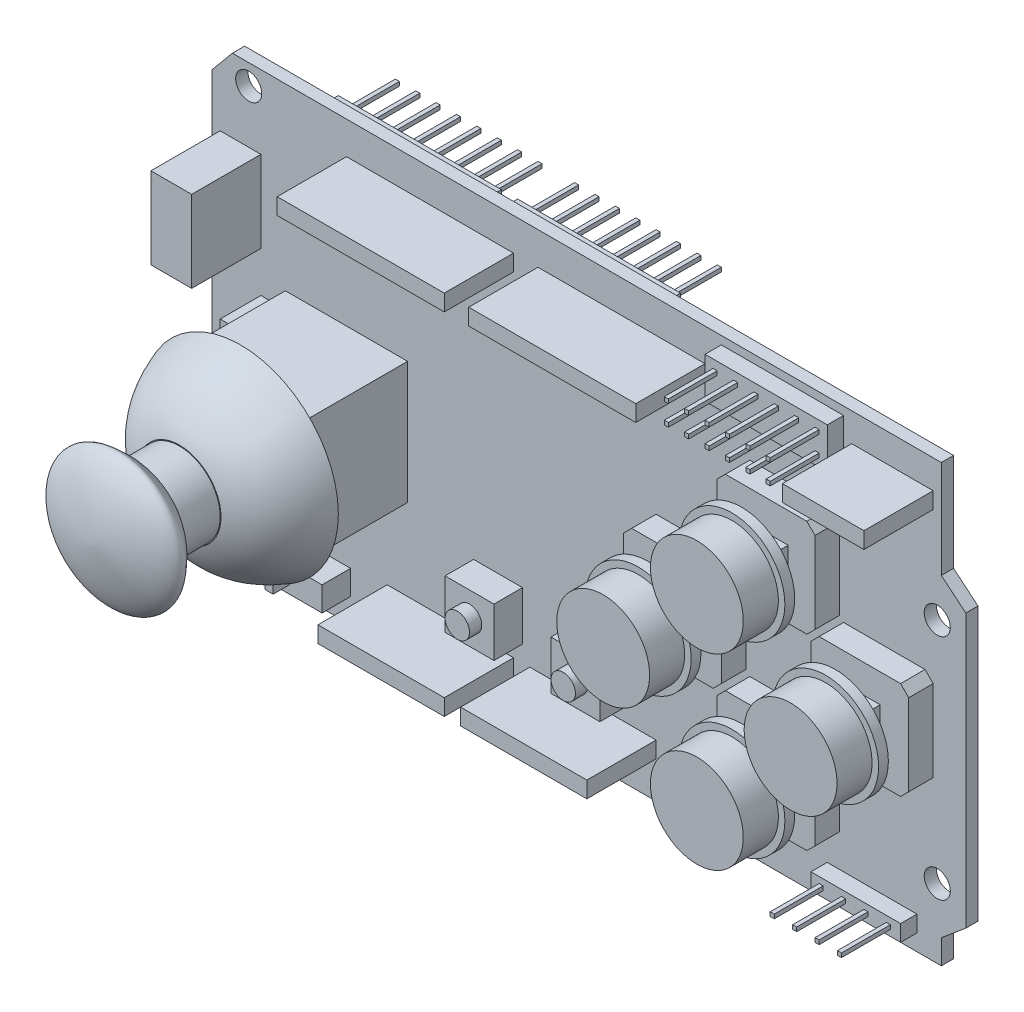
from build123d import *

# Parameters (mm, degrees)
EXTRUDE_1_DEPTH            = 1.5
SKETCH_3_R                 = 1.6
CUT_EXTRUDE_1_DEPTH        = 104.853261865
SKETCH_4_W                 = 12
SKETCH_4_H                 = 12
EXTRUDE_2_DEPTH            = 3
CHAMFER_1_SIZE             = 1
CHAMFER_1_OF_MIRROR_1_SIZE = 1
EXTRUDE_4_DEPTH            = 3
SKETCH_7_W                 = 5
SKETCH_7_H                 = 5
EXTRUDE_5_DEPTH            = 3
SKETCH_8_R                 = 6.5
EXTRUDE_6_DEPTH            = 1.2
SKETCH_9_R                 = 5.7
EXTRUDE_7_DEPTH            = 4.3
SKETCH_10_R                = 6.5
EXTRUDE_8_DEPTH            = 1.2
SKETCH_11_R                = 5.7
EXTRUDE_9_DEPTH            = 4.3
EXTRUDE_10_DEPTH           = 13
SKETCH_16_R                = 5.1
EXTRUDE_11_DEPTH           = 13
SKETCH_18_W                = 3
SKETCH_18_H                = 8
CUT_EXTRUDE_2_DEPTH        = 99.132563425
SKETCH_19_R                = 5
EXTRUDE_12_DEPTH           = 5
SKETCH_21_W                = 15
SKETCH_21_H                = 5
EXTRUDE_13_DEPTH           = 2
SKETCH_22_W                = 11
SKETCH_22_H                = 2
EXTRUDE_14_DEPTH           = 2
SKETCH_23_W                = 0.5
SKETCH_23_H                = 0.5
EXTRUDE_15_DEPTH           = 6
PATTERN_LINEAR_1_COUNT     = 4
PATTERN_LINEAR_1_PITCH     = 2.75
SKETCH_24_W                = 0.5
SKETCH_24_H                = 0.5
EXTRUDE_16_DEPTH           = 6
PATTERN_LINEAR_2_COUNT     = 6
PATTERN_LINEAR_2_PITCH     = 2.5
SKETCH_25_W                = 10
SKETCH_25_H                = 2
SKETCH_25_W_2              = 20.5
SKETCH_25_W_3              = 5
SKETCH_25_H_2              = 10
SKETCH_25_W_4              = 15.5
EXTRUDE_17_DEPTH           = 8.5
SKETCH_26_W                = 9
SKETCH_26_H                = 3
EXTRUDE_18_DEPTH           = 3.5
SKETCH_27_W                = 1
SKETCH_27_H                = 1
EXTRUDE_19_DEPTH           = 2
SKETCH_28_W                = 6
SKETCH_28_H                = 6
EXTRUDE_20_DEPTH           = 3.5
SKETCH_29_R                = 1.5
EXTRUDE_21_DEPTH           = 1.5
SKETCH_30_W                = 15
SKETCH_30_H                = 2
SKETCH_30_W_2              = 20
EXTRUDE_22_DEPTH           = 2
SKETCH_31_W                = 0.5
SKETCH_31_H                = 0.5
EXTRUDE_23_DEPTH           = 6
PATTERN_LINEAR_3_COUNT     = 6
PATTERN_LINEAR_3_PITCH     = 2.5
SKETCH_32_W                = 0.5
SKETCH_32_H                = 0.5
EXTRUDE_24_DEPTH           = 6
PATTERN_LINEAR_4_COUNT     = 8
PATTERN_LINEAR_4_PITCH     = 2.5


with BuildPart() as part:
    # 草图2 → 凸台-拉伸1 (new body)
    with BuildSketch(Plane.XY):
        Polygon((0, 0), (86, 0), (86, 3), (89, 5.5), (89, 39), (86, 41.5), (86, 53.5), (-1, 53.5), (-3.5, 50.5), (-3.5, 17.5), (0, 14), align=None)
    extrude(amount=EXTRUDE_1_DEPTH)

    # 草图3 → 切除-拉伸1 (cut, through all)
    with BuildSketch(Plane.XY.offset(1.5)):
        with Locations((85.5, 36.5)):
            Circle(SKETCH_3_R)
        with Locations((85.5, 8.5)):
            Circle(SKETCH_3_R)
        with Locations((1, 51)):
            Circle(SKETCH_3_R)
    extrude(amount=-CUT_EXTRUDE_1_DEPTH, mode=Mode.SUBTRACT)

    # 草图4 → 凸台-拉伸2 (add)
    with BuildSketch(Plane.XY.offset(1.5)):
        with Locations((79, 24.5)):
            Rectangle(SKETCH_4_W, SKETCH_4_H)
    extrude_2 = extrude(amount=EXTRUDE_2_DEPTH)

    # 倒角1
    chamfer_1_edges = [part.edges().sort_by_distance(p)[0] for p in [
        (85, 18.5, 3),
        (85, 30.5, 3),
        (73, 30.5, 3),
        (73, 18.5, 3),
    ]]
    chamfer(chamfer_1_edges, length=CHAMFER_1_SIZE)

    # 镜向1: 凸台-拉伸2 across plane
    add(extrude_2.mirror(Plane.ZY.offset(-67.5)))

    # 倒角1 of 镜向1
    chamfer_1_of_mirror_1_edges = [part.edges().sort_by_distance(p)[0] for p in [
        (50, 18.5, 3),
        (50, 30.5, 3),
        (62, 30.5, 3),
        (62, 18.5, 3),
    ]]
    chamfer(chamfer_1_of_mirror_1_edges, length=CHAMFER_1_OF_MIRROR_1_SIZE)

    # 草图6 → 凸台-拉伸4 (add)
    with BuildSketch(Plane.XY.offset(1.5)):
        Polygon((72.5, 42), (73.5, 41), (73.5, 31), (72.5, 30), (62.5, 30), (61.5, 31), (61.5, 41), (62.5, 42), align=None)
        Polygon((72.5, 19), (62.5, 19), (61.5, 18), (61.5, 8), (62.5, 7), (72.5, 7), (73.5, 8), (73.5, 18), align=None)
    extrude(amount=EXTRUDE_4_DEPTH)

    # 草图7 → 凸台-拉伸5 (add)
    with BuildSketch(Plane.XY.offset(4.5)):
        with Locations((67.706693111, 35.808222685)):
            Rectangle(SKETCH_7_W, SKETCH_7_H)
        with Locations((79, 24.5)):
            Rectangle(SKETCH_7_W, SKETCH_7_H)
        with Locations((56.065046095, 24.571111666)):
            Rectangle(SKETCH_7_W, SKETCH_7_H)
        with Locations((67.347105558, 12.884516206)):
            Rectangle(SKETCH_7_W, SKETCH_7_H)
    extrude(amount=EXTRUDE_5_DEPTH)

    # 草图8 → 凸台-拉伸6 (add)
    with BuildSketch(Plane.XY.offset(7.5)):
        with Locations((67.5, 36)):
            Circle(SKETCH_8_R)
        with Locations((67.5, 13)):
            Circle(SKETCH_8_R)
    extrude(amount=EXTRUDE_6_DEPTH)

    # 草图9 → 凸台-拉伸7 (add)
    with BuildSketch(Plane.XY.offset(8.7)):
        with Locations(Location((67.5, 36, 0), (0, 0, 180))):
            Circle(SKETCH_9_R)
        with Locations(Location((67.5, 13, 0), (0, 0, 180))):
            Circle(SKETCH_9_R)
    extrude(amount=EXTRUDE_7_DEPTH)

    # 草图10 → 凸台-拉伸8 (add)
    with BuildSketch(Plane.XY.offset(7.5)):
        with Locations((56, 24.5)):
            Circle(SKETCH_10_R)
        with Locations((79, 24.5)):
            Circle(SKETCH_10_R)
    extrude(amount=EXTRUDE_8_DEPTH)

    # 草图11 → 凸台-拉伸9 (add)
    with BuildSketch(Plane.XY.offset(8.7)):
        with Locations(Location((56, 24.5, 0), (0, 0, 180))):
            Circle(SKETCH_11_R)
        with Locations(Location((79, 24.5, 0), (0, 0, 180))):
            Circle(SKETCH_11_R)
    extrude(amount=EXTRUDE_9_DEPTH)

    # 草图13 → 凸台-拉伸10 (add)
    with BuildSketch(Plane.XY.offset(1.5)):
        Polygon((5.5, 29.5), (2.5, 29.5), (2.5, 18.5), (5.5, 18.5), (5.5, 16.5), (20.5, 16.5), (20.5, 31.5), (5.5, 31.5), align=None)
    extrude(amount=EXTRUDE_10_DEPTH)

    # 草图16 → 凸台-拉伸11 (add)
    with BuildSketch(Plane.XY.offset(22)):
        with Locations((13, 24)):
            Circle(SKETCH_16_R)
    extrude(amount=-EXTRUDE_11_DEPTH)

    # 草图17 → 旋转1 (revolve)
    with BuildSketch(Plane(origin=(0, 24, 0), x_dir=(-1, 0, 0), z_dir=(0, -1, 0))):
        with BuildLine():
            Line((-18.1, -22), (-13, -22))
            Line((-13, -22), (-13, -14.5))
            Line((-13, -14.5), (-25, -14.5))
            add(Edge.make_bspline(
                [(-18.1, -22), (-23.064296157, -20.389066726), (-25, -14.5)],
                knots=[0, 0, 0, 1, 1, 1], degree=2))
        make_face()
    revolve(axis=Axis((13, 24, 22), (0, 0, -1)))

    # 草图18 → 切除-拉伸2 (cut, through all)
    with BuildSketch(Plane.XZ.offset(-18.5)):
        with Locations((4, 10.5)):
            Rectangle(SKETCH_18_W, SKETCH_18_H)
    extrude(amount=-CUT_EXTRUDE_2_DEPTH, mode=Mode.SUBTRACT)

    # 草图19 → 凸台-拉伸12 (add)
    with BuildSketch(Plane.XY.offset(22)):
        with Locations((13, 24)):
            Circle(SKETCH_19_R)
    extrude(amount=EXTRUDE_12_DEPTH)

    # 草图20 → 旋转2 (revolve)
    with BuildSketch(Plane(origin=(0, 24, 0), x_dir=(-1, 0, 0), z_dir=(0, -1, 0))):
        with BuildLine():
            Line((-13, -27), (-13, -33))
            add(Edge.make_bspline(
                [(-13, -33), (-17.425780437, -32.750634073), (-22.378012438, -30.581264247), (-20.708427636, -28.866872144), (-19.14993505, -27.047457163), (-18, -27)],
                knots=[0, 0, 0, 0, 0.726318643, 0.826318643, 1, 1, 1, 1], degree=3))
            Line((-18, -27), (-13, -27))
        make_face()
    revolve(axis=Axis((13, 24, 27), (0, 0, 1)))

    # 草图21 → 凸台-拉伸13 (add)
    with BuildSketch(Plane.XY.offset(1.5)):
        with Locations((66.5, 50)):
            Rectangle(SKETCH_21_W, SKETCH_21_H)
    extrude(amount=EXTRUDE_13_DEPTH)

    # 草图22 → 凸台-拉伸14 (add)
    with BuildSketch(Plane.XY.offset(1.5)):
        with Locations((77.5, 3)):
            Rectangle(SKETCH_22_W, SKETCH_22_H)
    extrude(amount=EXTRUDE_14_DEPTH)

    # 草图23 → 凸台-拉伸15 (add)
    with BuildSketch(Plane.XY.offset(3.5)):
        with Locations((73.25, 3)):
            Rectangle(SKETCH_23_W, SKETCH_23_H)
    extrude_15 = extrude(amount=EXTRUDE_15_DEPTH)

    # 阵列(线性)1: 凸台-拉伸15 ×4
    with Locations(*[(i * PATTERN_LINEAR_1_PITCH, 0, 0) for i in range(1, PATTERN_LINEAR_1_COUNT)]):
        add(extrude_15)

    # 草图24 → 凸台-拉伸16 (add)
    with BuildSketch(Plane.XY.offset(3.5)):
        with Locations((72.75, 48.75)):
            Rectangle(SKETCH_24_W, SKETCH_24_H)
        with Locations((72.75, 51.25)):
            Rectangle(SKETCH_24_W, SKETCH_24_H)
    extrude_16 = extrude(amount=EXTRUDE_16_DEPTH)

    # 阵列(线性)2: 凸台-拉伸16 ×6
    with Locations(*[(-i * PATTERN_LINEAR_2_PITCH, 0, 0) for i in range(1, PATTERN_LINEAR_2_COUNT)]):
        add(extrude_16)

    # 草图25 → 凸台-拉伸17 (add)
    with BuildSketch(Plane.XY.offset(1.5)):
        with Locations((80, 49)):
            Rectangle(SKETCH_25_W, SKETCH_25_H)
        with Locations((46.75, 48.5)):
            Rectangle(SKETCH_25_W_2, SKETCH_25_H)
        with Locations((23.25, 48.5)):
            Rectangle(SKETCH_25_W_2, SKETCH_25_H)
        with Locations((0, 39.5)):
            Rectangle(SKETCH_25_W_3, SKETCH_25_H_2)
        with Locations((43.25, 5.5)):
            Rectangle(SKETCH_25_W_4, SKETCH_25_H)
        with Locations((25.75, 5.5)):
            Rectangle(SKETCH_25_W_4, SKETCH_25_H)
    extrude(amount=EXTRUDE_17_DEPTH)

    # 草图26 → 凸台-拉伸18 (add)
    with BuildSketch(Plane.XY.offset(1.5)):
        with Locations((9, 4.5)):
            Rectangle(SKETCH_26_W, SKETCH_26_H)
    extrude(amount=EXTRUDE_18_DEPTH)

    # 草图27 → 凸台-拉伸19 (add)
    with BuildSketch(Plane.XY.offset(5)):
        with Locations((9, 4.5)):
            Rectangle(SKETCH_27_W, SKETCH_27_H)
    extrude(amount=EXTRUDE_19_DEPTH)

    # 草图28 → 凸台-拉伸20 (add)
    with BuildSketch(Plane.XY.offset(1.5)):
        with Locations((31.6, 11.5)):
            Rectangle(SKETCH_28_W, SKETCH_28_H)
        with Locations((44.6, 11.5)):
            Rectangle(SKETCH_28_W, SKETCH_28_H)
    extrude(amount=EXTRUDE_20_DEPTH)

    # 草图29 → 凸台-拉伸21 (add)
    with BuildSketch(Plane.XY.offset(5)):
        with Locations((31.6, 11.5)):
            Circle(SKETCH_29_R)
        with Locations((44.6, 11.5)):
            Circle(SKETCH_29_R)
    extrude(amount=EXTRUDE_21_DEPTH)

    # 草图30 → 凸台-拉伸22 (add)
    with BuildSketch(Plane(origin=(0, 0, 0), x_dir=(-1, 0, 0), z_dir=(0, 0, -1))):
        with Locations((-25.5, 3)):
            Rectangle(SKETCH_30_W, SKETCH_30_H)
        with Locations((-43.5, 3)):
            Rectangle(SKETCH_30_W, SKETCH_30_H)
        with Locations((-18.5, 51)):
            Rectangle(SKETCH_30_W_2, SKETCH_30_H)
        with Locations((-40.5, 51)):
            Rectangle(SKETCH_30_W_2, SKETCH_30_H)
    extrude(amount=EXTRUDE_22_DEPTH)

    # 草图31 → 凸台-拉伸23 (add)
    with BuildSketch(Plane(origin=(0, 0, -2), x_dir=(-1, 0, 0), z_dir=(0, 0, -1))):
        with Locations((-19.25, 3)):
            Rectangle(SKETCH_31_W, SKETCH_31_H)
        with Locations((-37.25, 3)):
            Rectangle(SKETCH_31_W, SKETCH_31_H)
    extrude_23 = extrude(amount=EXTRUDE_23_DEPTH)

    # 阵列(线性)3: 凸台-拉伸23 ×6
    with Locations(*[(i * PATTERN_LINEAR_3_PITCH, 0, 0) for i in range(1, PATTERN_LINEAR_3_COUNT)]):
        add(extrude_23)

    # 草图32 → 凸台-拉伸24 (add)
    with BuildSketch(Plane(origin=(0, 0, -2), x_dir=(-1, 0, 0), z_dir=(0, 0, -1))):
        with Locations((-9.75, 51)):
            Rectangle(SKETCH_32_W, SKETCH_32_H)
        with Locations((-31.75, 51)):
            Rectangle(SKETCH_32_W, SKETCH_32_H)
    extrude_24 = extrude(amount=EXTRUDE_24_DEPTH)

    # 阵列(线性)4: 凸台-拉伸24 ×8
    with Locations(*[(i * PATTERN_LINEAR_4_PITCH, 0, 0) for i in range(1, PATTERN_LINEAR_4_COUNT)]):
        add(extrude_24)


solid = part.part
